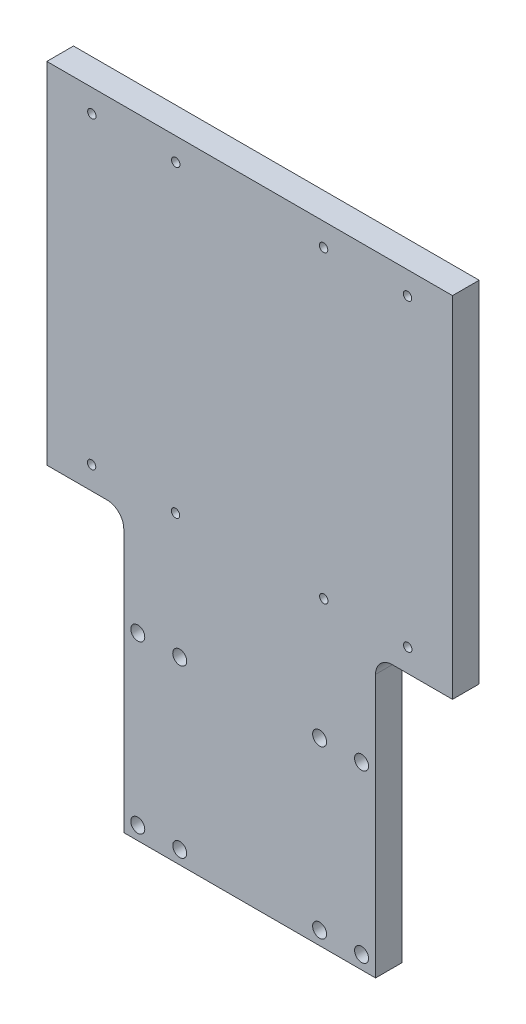
from build123d import *

# Parameters (mm, degrees)
RESSALTO_EXTRUS_O1_DEPTH = 9.53
CORTE_EXTRUS_O1_REACH    = 179.792
ESBO_O2_R                = 2.5
CORTE_EXTRUS_O2_REACH    = 179.792
ESBO_O3_R                = 1.5
CROQUIS1_W               = 1
CROQUIS1_H               = 125
SALIENTE_EXTRUIR1_DEPTH  = 9.53
REDONDEO1_R              = 6


with BuildPart() as part:
    # Esboço1 → Ressalto-extrusão1 (new body)
    with BuildSketch(Plane.XY):
        Polygon((-71.505, 62.5), (71.505, 62.5), (71.505, -62.5), (45, -62.5), (45, -162.5), (-45, -162.5), (-45, -62.5), (-71.505, -62.5), align=None)
    extrude(amount=RESSALTO_EXTRUS_O1_DEPTH)

    # Esboço2 → Corte-extrusão1 (cut, up to next)
    with BuildSketch(Plane.XY.offset(9.53), mode=Mode.PRIVATE) as corte_extrus_o1_sk1:
        with Locations((-40, -157.7)):
            Circle(ESBO_O2_R)
    corte_extrus_o1_tool1 = extrude(corte_extrus_o1_sk1.sketch, amount=-CORTE_EXTRUS_O1_REACH, mode=Mode.PRIVATE) & part.part
    # Esboço2 → Corte-extrusão1 (cut, up to next)
    with BuildSketch(Plane.XY.offset(9.53), mode=Mode.PRIVATE) as corte_extrus_o1_sk2:
        with Locations((-25, -157.7)):
            Circle(ESBO_O2_R)
    corte_extrus_o1_tool2 = extrude(corte_extrus_o1_sk2.sketch, amount=-CORTE_EXTRUS_O1_REACH, mode=Mode.PRIVATE) & part.part
    # Esboço2 → Corte-extrusão1 (cut, up to next)
    with BuildSketch(Plane.XY.offset(9.53), mode=Mode.PRIVATE) as corte_extrus_o1_sk3:
        with Locations((25, -157.7)):
            Circle(ESBO_O2_R)
    corte_extrus_o1_tool3 = extrude(corte_extrus_o1_sk3.sketch, amount=-CORTE_EXTRUS_O1_REACH, mode=Mode.PRIVATE) & part.part
    # Esboço2 → Corte-extrusão1 (cut, up to next)
    with BuildSketch(Plane.XY.offset(9.53), mode=Mode.PRIVATE) as corte_extrus_o1_sk4:
        with Locations((40, -157.7)):
            Circle(ESBO_O2_R)
    corte_extrus_o1_tool4 = extrude(corte_extrus_o1_sk4.sketch, amount=-CORTE_EXTRUS_O1_REACH, mode=Mode.PRIVATE) & part.part
    # Esboço2 → Corte-extrusão1 (cut, up to next)
    with BuildSketch(Plane.XY.offset(9.53), mode=Mode.PRIVATE) as corte_extrus_o1_sk5:
        with Locations((40, -98.2)):
            Circle(ESBO_O2_R)
    corte_extrus_o1_tool5 = extrude(corte_extrus_o1_sk5.sketch, amount=-CORTE_EXTRUS_O1_REACH, mode=Mode.PRIVATE) & part.part
    # Esboço2 → Corte-extrusão1 (cut, up to next)
    with BuildSketch(Plane.XY.offset(9.53), mode=Mode.PRIVATE) as corte_extrus_o1_sk6:
        with Locations((25, -98.2)):
            Circle(ESBO_O2_R)
    corte_extrus_o1_tool6 = extrude(corte_extrus_o1_sk6.sketch, amount=-CORTE_EXTRUS_O1_REACH, mode=Mode.PRIVATE) & part.part
    # Esboço2 → Corte-extrusão1 (cut, up to next)
    with BuildSketch(Plane.XY.offset(9.53), mode=Mode.PRIVATE) as corte_extrus_o1_sk7:
        with Locations((-25, -98.2)):
            Circle(ESBO_O2_R)
    corte_extrus_o1_tool7 = extrude(corte_extrus_o1_sk7.sketch, amount=-CORTE_EXTRUS_O1_REACH, mode=Mode.PRIVATE) & part.part
    # Esboço2 → Corte-extrusão1 (cut, up to next)
    with BuildSketch(Plane.XY.offset(9.53), mode=Mode.PRIVATE) as corte_extrus_o1_sk8:
        with Locations((-40, -98.2)):
            Circle(ESBO_O2_R)
    corte_extrus_o1_tool8 = extrude(corte_extrus_o1_sk8.sketch, amount=-CORTE_EXTRUS_O1_REACH, mode=Mode.PRIVATE) & part.part
    add(corte_extrus_o1_tool1.solids().sort_by_distance((-40, -157.7, 9.53))[0], mode=Mode.SUBTRACT)
    add(corte_extrus_o1_tool2.solids().sort_by_distance((-25, -157.7, 9.53))[0], mode=Mode.SUBTRACT)
    add(corte_extrus_o1_tool3.solids().sort_by_distance((25, -157.7, 9.53))[0], mode=Mode.SUBTRACT)
    add(corte_extrus_o1_tool4.solids().sort_by_distance((40, -157.7, 9.53))[0], mode=Mode.SUBTRACT)
    add(corte_extrus_o1_tool5.solids().sort_by_distance((40, -98.2, 9.53))[0], mode=Mode.SUBTRACT)
    add(corte_extrus_o1_tool6.solids().sort_by_distance((25, -98.2, 9.53))[0], mode=Mode.SUBTRACT)
    add(corte_extrus_o1_tool7.solids().sort_by_distance((-25, -98.2, 9.53))[0], mode=Mode.SUBTRACT)
    add(corte_extrus_o1_tool8.solids().sort_by_distance((-40, -98.2, 9.53))[0], mode=Mode.SUBTRACT)

    # Esboço3 → Corte-extrusão2 (cut, up to next)
    with BuildSketch(Plane(origin=(0, 0, 0), x_dir=(-1, 0, 0), z_dir=(0, 0, -1)), mode=Mode.PRIVATE) as corte_extrus_o2_sk1:
        with Locations((56.505, -54.325)):
            Circle(ESBO_O3_R)
    corte_extrus_o2_tool1 = extrude(corte_extrus_o2_sk1.sketch, amount=-CORTE_EXTRUS_O2_REACH, mode=Mode.PRIVATE) & part.part
    # Esboço3 → Corte-extrusão2 (cut, up to next)
    with BuildSketch(Plane(origin=(0, 0, 0), x_dir=(-1, 0, 0), z_dir=(0, 0, -1)), mode=Mode.PRIVATE) as corte_extrus_o2_sk2:
        with Locations((26.505, -54.325)):
            Circle(ESBO_O3_R)
    corte_extrus_o2_tool2 = extrude(corte_extrus_o2_sk2.sketch, amount=-CORTE_EXTRUS_O2_REACH, mode=Mode.PRIVATE) & part.part
    # Esboço3 → Corte-extrusão2 (cut, up to next)
    with BuildSketch(Plane(origin=(0, 0, 0), x_dir=(-1, 0, 0), z_dir=(0, 0, -1)), mode=Mode.PRIVATE) as corte_extrus_o2_sk3:
        with Locations((-26.505, -54.325)):
            Circle(ESBO_O3_R)
    corte_extrus_o2_tool3 = extrude(corte_extrus_o2_sk3.sketch, amount=-CORTE_EXTRUS_O2_REACH, mode=Mode.PRIVATE) & part.part
    # Esboço3 → Corte-extrusão2 (cut, up to next)
    with BuildSketch(Plane(origin=(0, 0, 0), x_dir=(-1, 0, 0), z_dir=(0, 0, -1)), mode=Mode.PRIVATE) as corte_extrus_o2_sk4:
        with Locations((-56.505, -54.325)):
            Circle(ESBO_O3_R)
    corte_extrus_o2_tool4 = extrude(corte_extrus_o2_sk4.sketch, amount=-CORTE_EXTRUS_O2_REACH, mode=Mode.PRIVATE) & part.part
    # Esboço3 → Corte-extrusão2 (cut, up to next)
    with BuildSketch(Plane(origin=(0, 0, 0), x_dir=(-1, 0, 0), z_dir=(0, 0, -1)), mode=Mode.PRIVATE) as corte_extrus_o2_sk5:
        with Locations((-56.423186497, 54.325)):
            Circle(ESBO_O3_R)
    corte_extrus_o2_tool5 = extrude(corte_extrus_o2_sk5.sketch, amount=-CORTE_EXTRUS_O2_REACH, mode=Mode.PRIVATE) & part.part
    # Esboço3 → Corte-extrusão2 (cut, up to next)
    with BuildSketch(Plane(origin=(0, 0, 0), x_dir=(-1, 0, 0), z_dir=(0, 0, -1)), mode=Mode.PRIVATE) as corte_extrus_o2_sk6:
        with Locations((-26.423186497, 54.325)):
            Circle(ESBO_O3_R)
    corte_extrus_o2_tool6 = extrude(corte_extrus_o2_sk6.sketch, amount=-CORTE_EXTRUS_O2_REACH, mode=Mode.PRIVATE) & part.part
    # Esboço3 → Corte-extrusão2 (cut, up to next)
    with BuildSketch(Plane(origin=(0, 0, 0), x_dir=(-1, 0, 0), z_dir=(0, 0, -1)), mode=Mode.PRIVATE) as corte_extrus_o2_sk7:
        with Locations((56.423186497, 54.325)):
            Circle(ESBO_O3_R)
    corte_extrus_o2_tool7 = extrude(corte_extrus_o2_sk7.sketch, amount=-CORTE_EXTRUS_O2_REACH, mode=Mode.PRIVATE) & part.part
    # Esboço3 → Corte-extrusão2 (cut, up to next)
    with BuildSketch(Plane(origin=(0, 0, 0), x_dir=(-1, 0, 0), z_dir=(0, 0, -1)), mode=Mode.PRIVATE) as corte_extrus_o2_sk8:
        with Locations((26.423186497, 54.325)):
            Circle(ESBO_O3_R)
    corte_extrus_o2_tool8 = extrude(corte_extrus_o2_sk8.sketch, amount=-CORTE_EXTRUS_O2_REACH, mode=Mode.PRIVATE) & part.part
    add(corte_extrus_o2_tool1.solids().sort_by_distance((-56.505, -54.325, 0))[0], mode=Mode.SUBTRACT)
    add(corte_extrus_o2_tool2.solids().sort_by_distance((-26.505, -54.325, 0))[0], mode=Mode.SUBTRACT)
    add(corte_extrus_o2_tool3.solids().sort_by_distance((26.505, -54.325, 0))[0], mode=Mode.SUBTRACT)
    add(corte_extrus_o2_tool4.solids().sort_by_distance((56.505, -54.325, 0))[0], mode=Mode.SUBTRACT)
    add(corte_extrus_o2_tool5.solids().sort_by_distance((56.423186, 54.325, 0))[0], mode=Mode.SUBTRACT)
    add(corte_extrus_o2_tool6.solids().sort_by_distance((26.423186, 54.325, 0))[0], mode=Mode.SUBTRACT)
    add(corte_extrus_o2_tool7.solids().sort_by_distance((-56.423186, 54.325, 0))[0], mode=Mode.SUBTRACT)
    add(corte_extrus_o2_tool8.solids().sort_by_distance((-26.423186, 54.325, 0))[0], mode=Mode.SUBTRACT)

    # Croquis1 → Saliente-Extruir1 (add)
    with BuildSketch(Plane.XY.offset(9.53)):
        with Locations((-72.005, 0)):
            Rectangle(CROQUIS1_W, CROQUIS1_H)
        with Locations((72.005, 0)):
            Rectangle(CROQUIS1_W, CROQUIS1_H)
    extrude(amount=-SALIENTE_EXTRUIR1_DEPTH)

    # Redondeo1
    redondeo1_edges = [part.edges().sort_by_distance(p)[0] for p in [
        (45, -62.5, 4.765),
        (-45, -62.5, 4.765),
    ]]
    fillet(redondeo1_edges, radius=REDONDEO1_R)


solid = part.part
